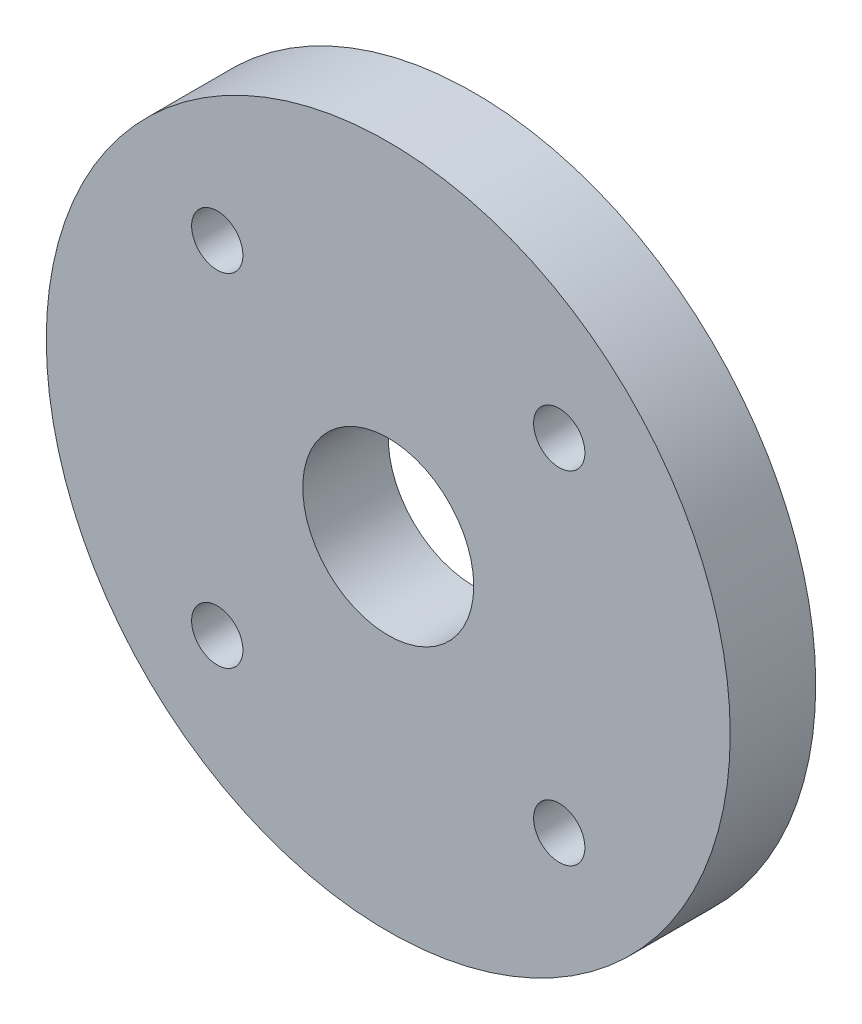
from build123d import *

# Parameters (mm, degrees)
SKETCH_1_R      = 20
SKETCH_1_R_2    = 5
SKETCH_1_R_3    = 1.5
EXTRUDE_1_DEPTH = 5


with BuildPart() as part:
    # 草圖1 → 填料-伸長1 (new body)
    with BuildSketch(Plane.XY):
        Circle(SKETCH_1_R)
        Circle(SKETCH_1_R_2, mode=Mode.SUBTRACT)
        with Locations((-10, -10)):
            Circle(SKETCH_1_R_3, mode=Mode.SUBTRACT)
        with Locations(Location((-10, 10, 0), (0, 0, 180))):
            Circle(SKETCH_1_R_3, mode=Mode.SUBTRACT)
        with Locations((10, 10)):
            Circle(SKETCH_1_R_3, mode=Mode.SUBTRACT)
        with Locations(Location((10, -10, 0), (0, 0, 180))):
            Circle(SKETCH_1_R_3, mode=Mode.SUBTRACT)
    extrude(amount=EXTRUDE_1_DEPTH)


solid = part.part
